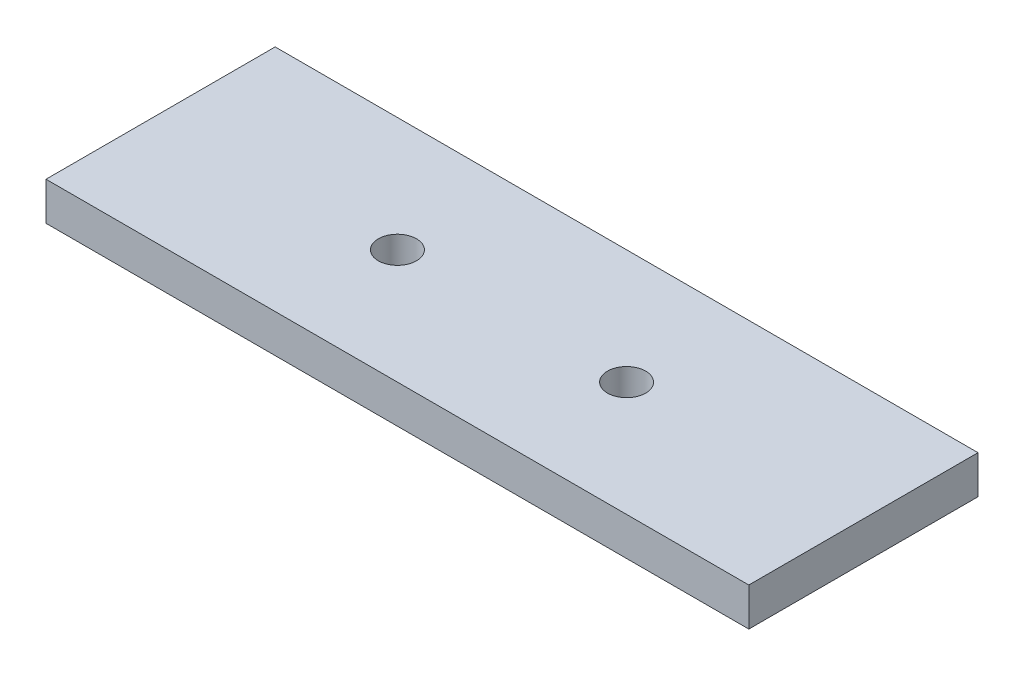
from build123d import *

# Parameters (mm, degrees)
SKETCH1_W           = 92
SKETCH1_H           = 30
BOSS_EXTRUDE1_DEPTH = 5
SKETCH2_R           = 2.5
CUT_EXTRUDE1_DEPTH  = 49.641546028


with BuildPart() as part:
    # Sketch1 → Boss-Extrude1 (new body)
    with BuildSketch(Plane(origin=(0, 0, 0), x_dir=(1, 0, 0), z_dir=(0, 1, 0))):
        Rectangle(SKETCH1_W, SKETCH1_H)
    extrude(amount=BOSS_EXTRUDE1_DEPTH)

    # Sketch2 → Cut-Extrude1 (cut, through all)
    with BuildSketch(Plane(origin=(0, 5, 0), x_dir=(1, 0, 0), z_dir=(0, 1, 0))):
        with Locations(Location((15, 0, 0), (0, 0, 270))):
            Circle(SKETCH2_R)
        with Locations(Location((-15, 0, 0), (0, 0, 270))):
            Circle(SKETCH2_R)
    extrude(amount=-CUT_EXTRUDE1_DEPTH, mode=Mode.SUBTRACT)


solid = part.part
